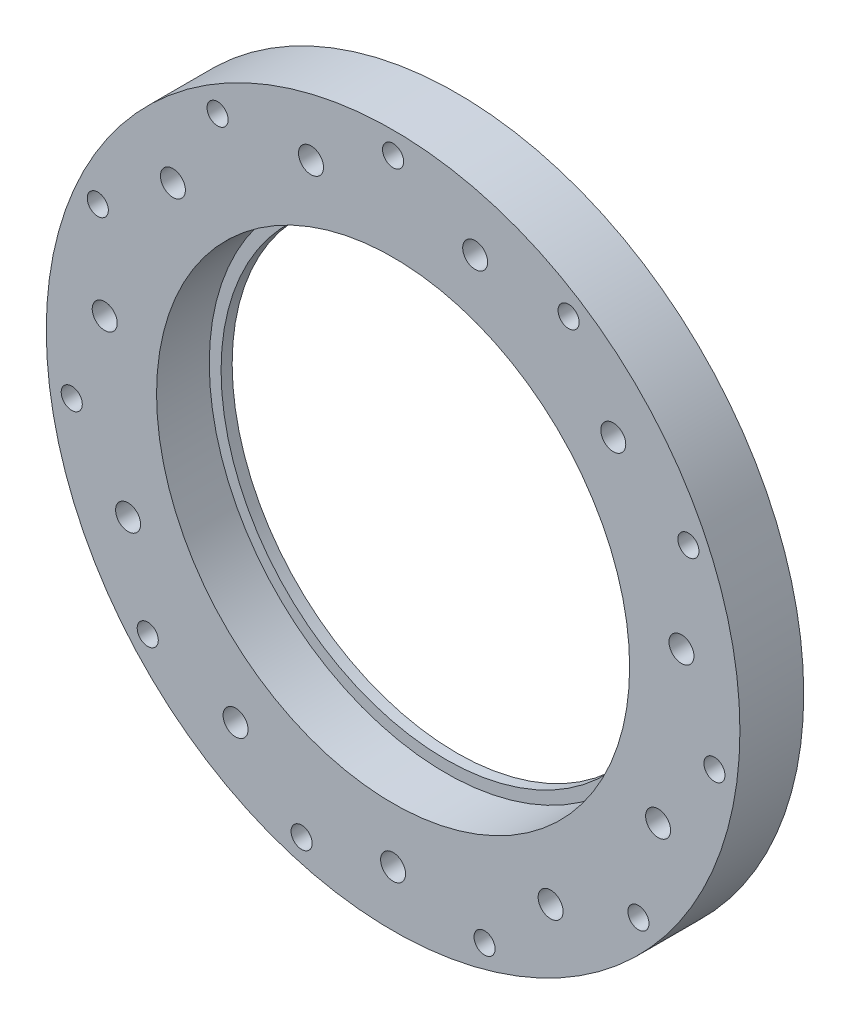
from build123d import *

# Parameters (mm, degrees)
SKETCH_1_R          = 62.5
SKETCH_1_R_2        = 40.5
SKETCH_1_R_3        = 2.25
SKETCH_1_R_4        = 1.9
EXTRUDE_1_DEPTH     = 11.5
SKETCH_2_R          = 42.625
CUT_EXTRUDE_1_DEPTH = 9.5


with BuildPart() as part:
    # 草图1 → 凸台-拉伸1 (new body)
    with BuildSketch(Plane.XY):
        Circle(SKETCH_1_R)
        Circle(SKETCH_1_R_2, mode=Mode.SUBTRACT)
        with Locations((0, -52.5)):
            Circle(SKETCH_1_R_3, mode=Mode.SUBTRACT)
        with Locations((-28.383642916, -44.165810474)):
            Circle(SKETCH_1_R_3, mode=Mode.SUBTRACT)
        with Locations((-47.755679756, -21.809288183)):
            Circle(SKETCH_1_R_3, mode=Mode.SUBTRACT)
        with Locations((-51.965625699, 7.471529009)):
            Circle(SKETCH_1_R_3, mode=Mode.SUBTRACT)
        with Locations((-39.676852654, 34.380188532)):
            Circle(SKETCH_1_R_3, mode=Mode.SUBTRACT)
        with Locations((-14.790959234, 50.373381115)):
            Circle(SKETCH_1_R_3, mode=Mode.SUBTRACT)
        with Locations((14.790959234, 50.373381115)):
            Circle(SKETCH_1_R_3, mode=Mode.SUBTRACT)
        with Locations((39.676852654, 34.380188532)):
            Circle(SKETCH_1_R_3, mode=Mode.SUBTRACT)
        with Locations((51.965625699, 7.471529009)):
            Circle(SKETCH_1_R_3, mode=Mode.SUBTRACT)
        with Locations((47.755679756, -21.809288183)):
            Circle(SKETCH_1_R_3, mode=Mode.SUBTRACT)
        with Locations((28.383642916, -44.165810474)):
            Circle(SKETCH_1_R_3, mode=Mode.SUBTRACT)
        with Locations((-44.2113501, -38.309352936)):
            Circle(SKETCH_1_R_4, mode=Mode.SUBTRACT)
        with Locations((-57.90455435, -8.325418039)):
            Circle(SKETCH_1_R_4, mode=Mode.SUBTRACT)
        with Locations((-53.213471728, 24.301778261)):
            Circle(SKETCH_1_R_4, mode=Mode.SUBTRACT)
        with Locations((-31.627487821, 49.213331671)):
            Circle(SKETCH_1_R_4, mode=Mode.SUBTRACT)
        with Locations((0, 58.5)):
            Circle(SKETCH_1_R_4, mode=Mode.SUBTRACT)
        with Locations((31.627487821, 49.213331671)):
            Circle(SKETCH_1_R_4, mode=Mode.SUBTRACT)
        with Locations((53.213471728, 24.301778261)):
            Circle(SKETCH_1_R_4, mode=Mode.SUBTRACT)
        with Locations((57.90455435, -8.325418039)):
            Circle(SKETCH_1_R_4, mode=Mode.SUBTRACT)
        with Locations((44.2113501, -38.309352936)):
            Circle(SKETCH_1_R_4, mode=Mode.SUBTRACT)
        with Locations((16.481354575, -56.130338956)):
            Circle(SKETCH_1_R_4, mode=Mode.SUBTRACT)
        with Locations((-16.481354575, -56.130338956)):
            Circle(SKETCH_1_R_4, mode=Mode.SUBTRACT)
    extrude(amount=EXTRUDE_1_DEPTH)

    # 草图2 → 切除-拉伸1 (cut)
    with BuildSketch(Plane.XY.offset(11.5)):
        Circle(SKETCH_2_R)
    extrude(amount=-CUT_EXTRUDE_1_DEPTH, mode=Mode.SUBTRACT)


solid = part.part
